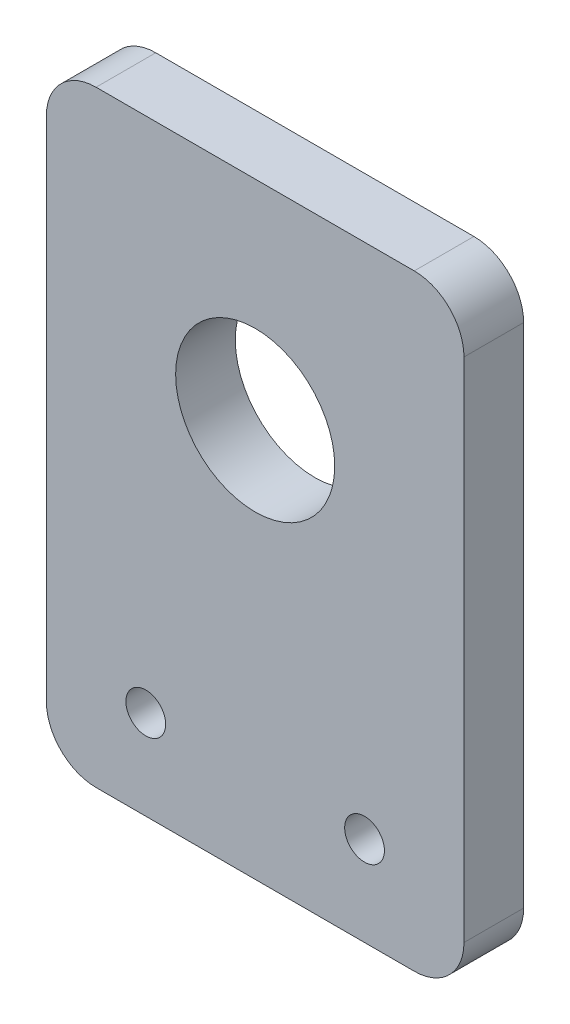
from build123d import *

# Parameters (mm, degrees)
SKETCH1_R           = 8
SKETCH1_R_2         = 2
BOSS_EXTRUDE1_DEPTH = 6


with BuildPart() as part:
    # Sketch1 → Boss-Extrude1 (new body)
    with BuildSketch(Plane.XY):
        with BuildLine():
            Line((5, 0), (37, 0))
            ThreePointArc((37, 0), (40.535533906, 1.464466094), (42, 5))
            Line((42, 5), (42, 56))
            ThreePointArc((42, 56), (40.535533906, 59.535533906), (37, 61))
            Line((37, 61), (5, 61))
            ThreePointArc((5, 61), (1.464466094, 59.535533906), (0, 56))
            Line((0, 56), (0, 5))
            ThreePointArc((0, 5), (1.464466094, 1.464466094), (5, 0))
        make_face()
        with Locations((21, 40)):
            Circle(SKETCH1_R, mode=Mode.SUBTRACT)
        with Locations((10, 9)):
            Circle(SKETCH1_R_2, mode=Mode.SUBTRACT)
        with Locations((32, 9)):
            Circle(SKETCH1_R_2, mode=Mode.SUBTRACT)
    extrude(amount=BOSS_EXTRUDE1_DEPTH)


solid = part.part
